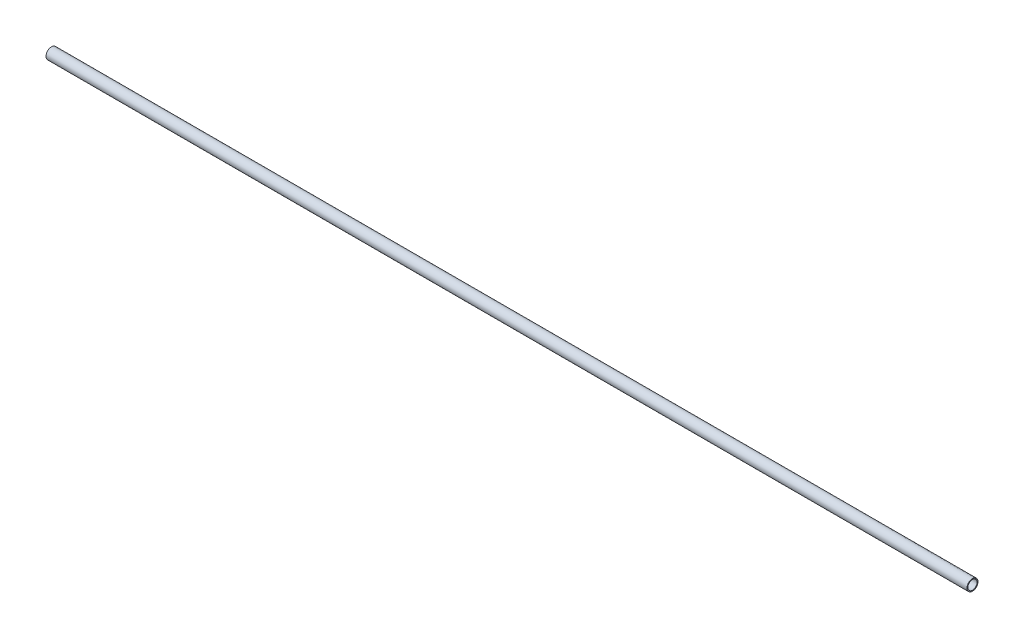
from build123d import *

# Parameters (mm, degrees)
SKETCH1_R           = 6
SKETCH1_R_2         = 5
BOSS_EXTRUDE1_DEPTH = 500


with BuildPart() as part:
    # Sketch1 → Boss-Extrude1 (new, symmetric)
    with BuildSketch(Plane(origin=(0, 0, 0), x_dir=(0, 0, -1), z_dir=(1, 0, 0))):
        Circle(SKETCH1_R)
        Circle(SKETCH1_R_2, mode=Mode.SUBTRACT)
    extrude(amount=BOSS_EXTRUDE1_DEPTH, both=True)


solid = part.part
